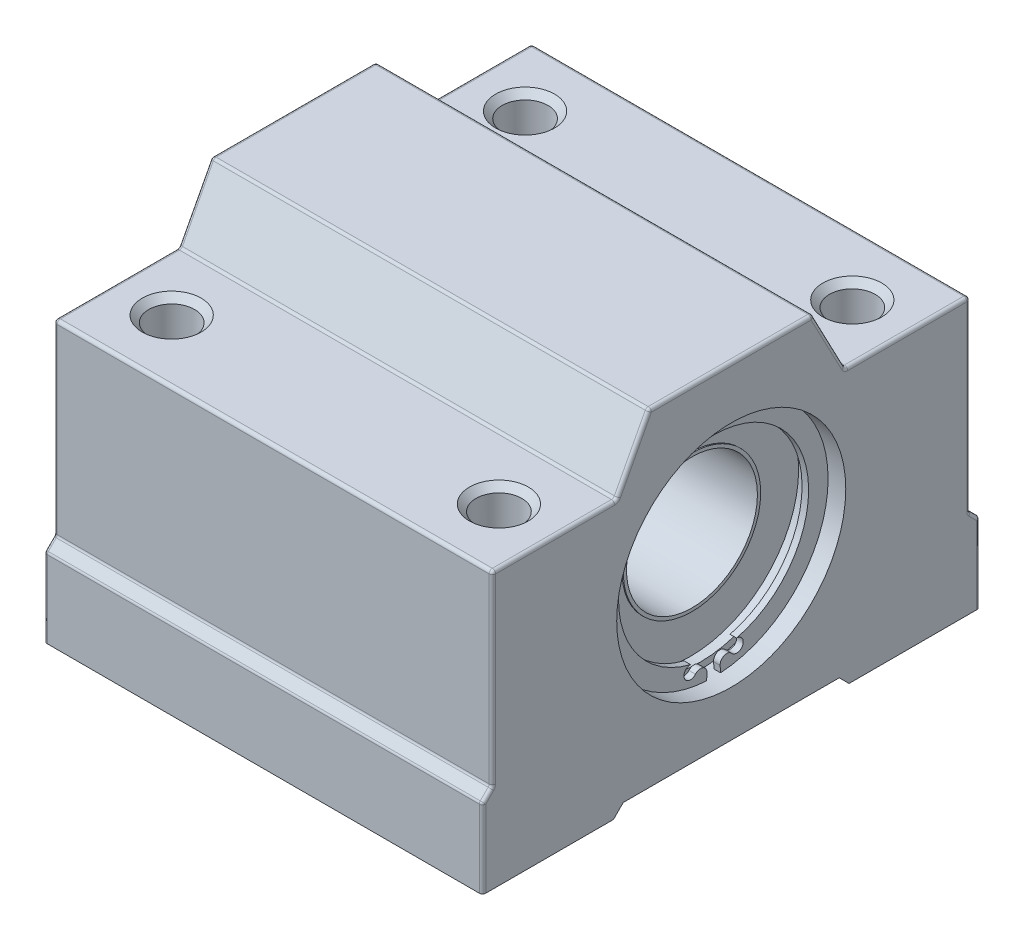
from build123d import *

# Parameters (mm, degrees)
SKETCH1_R           = 17.5
BOSS_EXTRUDE1_DEPTH = 67
EXTRUDE_THIN1_START = 0.5
SKETCH1_4_R         = 10.5
SKETCH1_4_R_2       = 10
EXTRUDE_THIN1_DEPTH = 60.5
BOSS_EXTRUDE2_START = 0.8
SKETCH1_5_R         = 16.5
SKETCH1_5_R_2       = 10
BOSS_EXTRUDE2_DEPTH = 60
BOSS_EXTRUDE3_START = 0.3
SKETCH1_6_R         = 17.5
SKETCH1_6_R_2       = 16.5
BOSS_EXTRUDE3_DEPTH = 62
BOSS_EXTRUDE4_START = 1
BOSS_EXTRUDE4_DEPTH = 1
FILLET1_R           = 0.5
SKETCH4_R           = 3.5
CUT_EXTRUDE3_DEPTH  = 93.656624156
CHAMFER1_SIZE       = 1


with BuildPart() as part:
    # Sketch1 → Boss-Extrude1 (new body)
    with BuildSketch(Plane(origin=(0, 0, 0), x_dir=(0, 0, -1), z_dir=(1, 0, 0))):
        Polygon((-38, -26), (-18, -26), (-16.5, -24.5), (16.5, -24.5), (18, -26), (38, -26), (38, -14), (36.5, -12.5), (36.5, 16), (17.5, 16), (12.5, 25.5), (-12.5, 25.5), (-17.5, 16), (-36.5, 16), (-36.5, -12.5), (-38, -14), align=None)
        Circle(SKETCH1_R, mode=Mode.SUBTRACT)
    extrude(amount=BOSS_EXTRUDE1_DEPTH)



with BuildPart() as body_2:
    # Sketch1<4> → Extrude-Thin1 (new body)
    with BuildSketch(Plane(origin=(0, 0, 0), x_dir=(0, 0, -1), z_dir=(1, 0, 0)).offset(EXTRUDE_THIN1_START)):
        Circle(SKETCH1_4_R)
        Circle(SKETCH1_4_R_2, mode=Mode.SUBTRACT)
    extrude(amount=EXTRUDE_THIN1_DEPTH)

    # Sketch1<5> → Boss-Extrude2 (add)
    with BuildSketch(Plane(origin=(0, 0, 0), x_dir=(0, 0, -1), z_dir=(1, 0, 0)).offset(BOSS_EXTRUDE2_START)):
        Circle(SKETCH1_5_R)
        Circle(SKETCH1_5_R_2, mode=Mode.SUBTRACT)
    extrude(amount=BOSS_EXTRUDE2_DEPTH)


with BuildPart() as part_1:
    add(part.part)

    add(body_2.part)  # Boss-Extrude3 merges body 2
    # Sketch1<6> → Boss-Extrude3 (add)
    with BuildSketch(Plane(origin=(0, 0, 0), x_dir=(0, 0, -1), z_dir=(1, 0, 0)).offset(BOSS_EXTRUDE3_START)):
        Circle(SKETCH1_6_R)
        Circle(SKETCH1_6_R_2, mode=Mode.SUBTRACT)
    extrude(amount=BOSS_EXTRUDE3_DEPTH)

    # Sketch3 → Boss-Extrude4 (add)
    with BuildSketch(Plane(origin=(62.3, 0, 0), x_dir=(0, 0, -1), z_dir=(1, 0, 0)).offset(BOSS_EXTRUDE4_START)):
        with BuildLine():
            Line((-1.004156134, -16.469416215), (-1.065014082, -17.467562652))
            ThreePointArc((-1.065014082, -17.467562652), (0, 17.5), (1.065014082, -17.467562652))
            Line((1.065014082, -17.467562652), (1.004156134, -16.469416215))
            ThreePointArc((1.004156134, -16.469416215), (1.615355414, -15.455274599), (2.765844781, -15.735313872))
            ThreePointArc((2.765844781, -15.735313872), (4.441889135, -15.506458328), (3.513397833, -14.092455697))
            ThreePointArc((3.513397833, -14.092455697), (0, 14.523817402), (-3.513397833, -14.092455697))
            ThreePointArc((-3.513397833, -14.092455697), (-4.441889135, -15.506458328), (-2.765844781, -15.735313872))
            ThreePointArc((-2.765844781, -15.735313872), (-1.615355414, -15.455274599), (-1.004156134, -16.469416215))
        make_face()
    extrude(amount=BOSS_EXTRUDE4_DEPTH)

    # Fillet1
    fillet1_edges = [part_1.edges().sort_by_distance(p)[0] for p in [
        (33.5, -12.5, -36.5),
        (33.5, -12.5, 36.5),
        (33.5, -14, 38),
        (33.5, -14, -38),
        (33.5, 16, -17.5),
        (33.5, 16, 17.5),
        (33.5, 25.5, 12.5),
        (33.5, 25.5, -12.5),
        (33.5, 16, -36.5),
        (33.5, 16, 36.5),
        (67, 20.75, -15),
        (67, 20.75, 15),
        (67, 1.75, 36.5),
        (0, -13.25, 37.25),
        (0, 20.75, 15),
        (67, -13.25, -37.25),
        (67, -20, -38),
        (67, 1.75, -36.5),
        (67, 25.5, 0),
        (67, 16, -27),
        (67, 16, 27),
        (67, -13.25, 37.25),
        (67, -20, 38),
        (0, -20, -38),
        (0, -13.25, -37.25),
        (0, 1.75, -36.5),
        (0, 20.75, -15),
        (0, 16, -27),
        (0, 25.5, 0),
        (0, -20, 38),
        (0, 1.75, 36.5),
        (0, 16, 27),
    ]]
    fillet(fillet1_edges, radius=FILLET1_R)

    # Sketch4 → Cut-Extrude3 (cut, through all)
    with BuildSketch(Plane.XZ.offset(26)):
        with Locations((8.5, 27)):
            Circle(SKETCH4_R)
        with Locations((58.5, 27)):
            Circle(SKETCH4_R)
        with Locations((58.5, -27)):
            Circle(SKETCH4_R)
        with Locations((8.5, -27)):
            Circle(SKETCH4_R)
    extrude(amount=-CUT_EXTRUDE3_DEPTH, mode=Mode.SUBTRACT)

    # Chamfer1
    chamfer1_edges = [part_1.edges().sort_by_distance(p)[0] for p in [
        (55, 16, -27),
        (5, 16, -27),
        (5, 16, 27),
        (55, 16, 27),
        (55, -26, 27),
        (5, -26, 27),
    ]]
    chamfer(chamfer1_edges, length=CHAMFER1_SIZE)


solid = part_1.part
